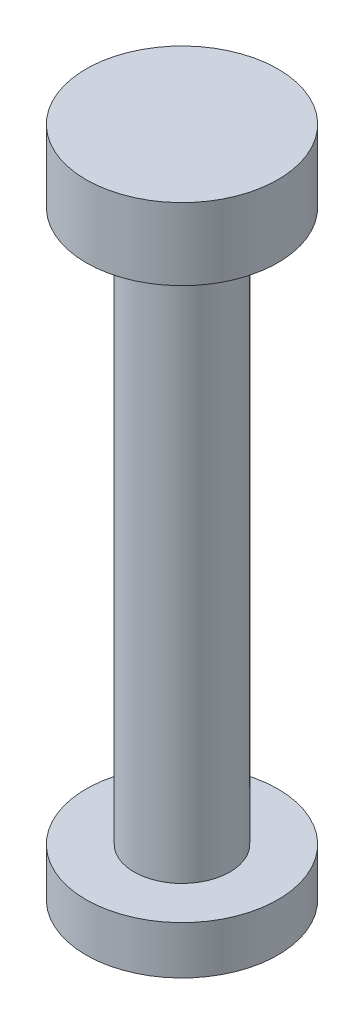
from build123d import *


with BuildPart() as part:
    # Sketch1 → Revolve1 (revolve)
    with BuildSketch(Plane.XY, mode=Mode.PRIVATE) as revolve1_sk:
        Polygon((0, 26), (4, 26), (4, 23), (2, 23), (2, 0), (4, 0), (4, -2), (0, -2), align=None)
    revolve(revolve1_sk.sketch.rotate(Axis((0, 0, 0), (0, 1, 0)), 90), axis=Axis((0, 0, 0), (0, 1, 0)))


solid = part.part
